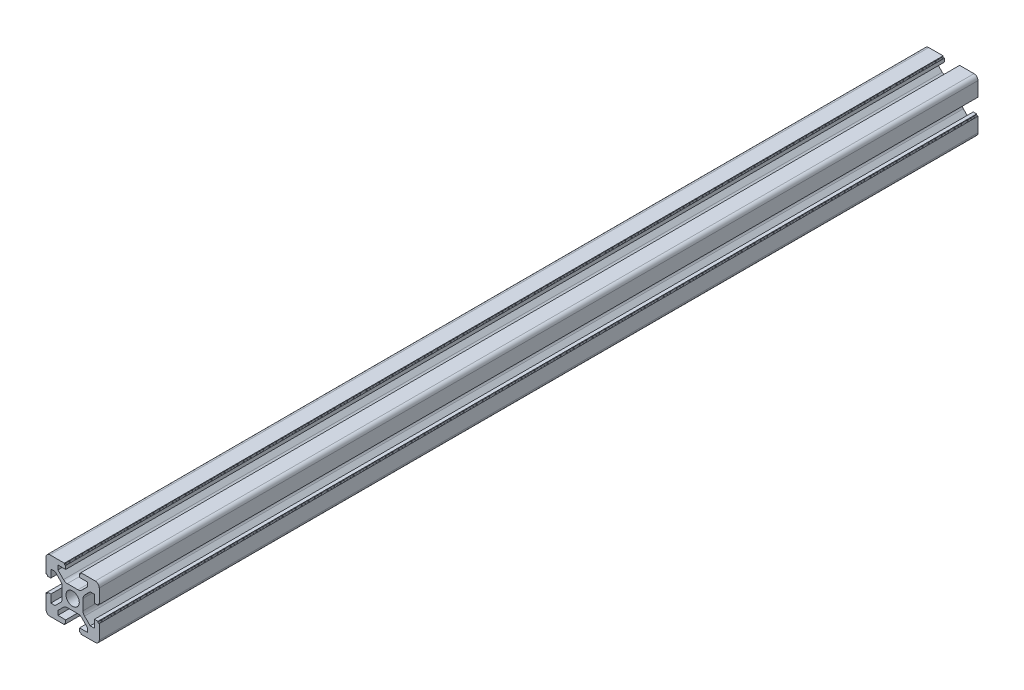
from build123d import *

# Parameters (mm, degrees)
SKETCH1_R      = 2.5
EXTRUDE1_DEPTH = 330


with BuildPart() as part:
    # Sketch1 → Extrude1 (new body)
    with BuildSketch(Plane.XY):
        with BuildLine():
            Line((0, 3.9), (-2.010912703, 3.9))
            ThreePointArc((-2.010912703, 3.9), (-2.776279568, 4.052240935), (-3.425126266, 4.485786438))
            Line((-3.425126266, 4.485786438), (-5.539339828, 6.6))
            Line((-5.539339828, 6.6), (-5.539339828, 8.2))
            Line((-5.539339828, 8.2), (-2.6, 8.2))
            Line((-2.6, 8.2), (-2.6, 9.5))
            Line((-2.6, 9.5), (-2.9, 9.5))
            ThreePointArc((-2.9, 9.5), (-3.041421356, 9.558578644), (-3.1, 9.7))
            Line((-3.1, 9.7), (-3.1, 10))
            Line((-3.1, 10), (-8.5, 10))
            ThreePointArc((-8.5, 10), (-9.560660172, 9.560660172), (-10, 8.5))
            Line((-10, 8.5), (-10, 3.1))
            Line((-10, 3.1), (-9.7, 3.1))
            ThreePointArc((-9.7, 3.1), (-9.558578644, 3.041421356), (-9.5, 2.9))
            Line((-9.5, 2.9), (-9.5, 2.6))
            Line((-9.5, 2.6), (-8.2, 2.6))
            Line((-8.2, 2.6), (-8.2, 5.539339828))
            Line((-8.2, 5.539339828), (-6.6, 5.539339828))
            Line((-6.6, 5.539339828), (-4.485786438, 3.425126266))
            ThreePointArc((-4.485786438, 3.425126266), (-4.052240935, 2.776279568), (-3.9, 2.010912703))
            Line((-3.9, 2.010912703), (-3.9, 0))
            Line((-3.9, 0), (-3.9, -2.010912703))
            ThreePointArc((-3.9, -2.010912703), (-4.052240935, -2.776279568), (-4.485786438, -3.425126266))
            Line((-4.485786438, -3.425126266), (-6.6, -5.539339828))
            Line((-6.6, -5.539339828), (-8.2, -5.539339828))
            Line((-8.2, -5.539339828), (-8.2, -2.6))
            Line((-8.2, -2.6), (-9.5, -2.6))
            Line((-9.5, -2.6), (-9.5, -2.9))
            ThreePointArc((-9.5, -2.9), (-9.558578644, -3.041421356), (-9.7, -3.1))
            Line((-9.7, -3.1), (-10, -3.1))
            Line((-10, -3.1), (-10, -8.5))
            ThreePointArc((-10, -8.5), (-9.560660172, -9.560660172), (-8.5, -10))
            Line((-8.5, -10), (-3.1, -10))
            Line((-3.1, -10), (-3.1, -9.7))
            ThreePointArc((-3.1, -9.7), (-3.041421356, -9.558578644), (-2.9, -9.5))
            Line((-2.9, -9.5), (-2.6, -9.5))
            Line((-2.6, -9.5), (-2.6, -8.2))
            Line((-2.6, -8.2), (-5.539339828, -8.2))
            Line((-5.539339828, -8.2), (-5.539339828, -6.6))
            Line((-5.539339828, -6.6), (-3.425126266, -4.485786438))
            ThreePointArc((-3.425126266, -4.485786438), (-2.776279568, -4.052240935), (-2.010912703, -3.9))
            Line((-2.010912703, -3.9), (0, -3.9))
            Line((0, -3.9), (2.010912703, -3.9))
            ThreePointArc((2.010912703, -3.9), (2.776279568, -4.052240935), (3.425126266, -4.485786438))
            Line((3.425126266, -4.485786438), (5.539339828, -6.6))
            Line((5.539339828, -6.6), (5.539339828, -8.2))
            Line((5.539339828, -8.2), (2.6, -8.2))
            Line((2.6, -8.2), (2.6, -9.5))
            Line((2.6, -9.5), (2.9, -9.5))
            ThreePointArc((2.9, -9.5), (3.041421356, -9.558578644), (3.1, -9.7))
            Line((3.1, -9.7), (3.1, -10))
            Line((3.1, -10), (8.5, -10))
            ThreePointArc((8.5, -10), (9.560660172, -9.560660172), (10, -8.5))
            Line((10, -8.5), (10, -3.1))
            Line((10, -3.1), (9.7, -3.1))
            ThreePointArc((9.7, -3.1), (9.558578644, -3.041421356), (9.5, -2.9))
            Line((9.5, -2.9), (9.5, -2.6))
            Line((9.5, -2.6), (8.2, -2.6))
            Line((8.2, -2.6), (8.2, -5.539339828))
            Line((8.2, -5.539339828), (6.6, -5.539339828))
            Line((6.6, -5.539339828), (4.485786438, -3.425126266))
            ThreePointArc((4.485786438, -3.425126266), (4.052240935, -2.776279568), (3.9, -2.010912703))
            Line((3.9, -2.010912703), (3.9, 0))
            Line((3.9, 0), (3.9, 2.010912703))
            ThreePointArc((3.9, 2.010912703), (4.052240935, 2.776279568), (4.485786438, 3.425126266))
            Line((4.485786438, 3.425126266), (6.6, 5.539339828))
            Line((6.6, 5.539339828), (8.2, 5.539339828))
            Line((8.2, 5.539339828), (8.2, 2.6))
            Line((8.2, 2.6), (9.5, 2.6))
            Line((9.5, 2.6), (9.5, 2.9))
            ThreePointArc((9.5, 2.9), (9.558578644, 3.041421356), (9.7, 3.1))
            Line((9.7, 3.1), (10, 3.1))
            Line((10, 3.1), (10, 8.5))
            ThreePointArc((10, 8.5), (9.560660172, 9.560660172), (8.5, 10))
            Line((8.5, 10), (3.1, 10))
            Line((3.1, 10), (3.1, 9.7))
            ThreePointArc((3.1, 9.7), (3.041421356, 9.558578644), (2.9, 9.5))
            Line((2.9, 9.5), (2.6, 9.5))
            Line((2.6, 9.5), (2.6, 8.2))
            Line((2.6, 8.2), (5.539339828, 8.2))
            Line((5.539339828, 8.2), (5.539339828, 6.6))
            Line((5.539339828, 6.6), (3.425126266, 4.485786438))
            ThreePointArc((3.425126266, 4.485786438), (2.776279568, 4.052240935), (2.010912703, 3.9))
            Line((2.010912703, 3.9), (0, 3.9))
        make_face()
        Circle(SKETCH1_R, mode=Mode.SUBTRACT)
    extrude(amount=EXTRUDE1_DEPTH)


solid = part.part
